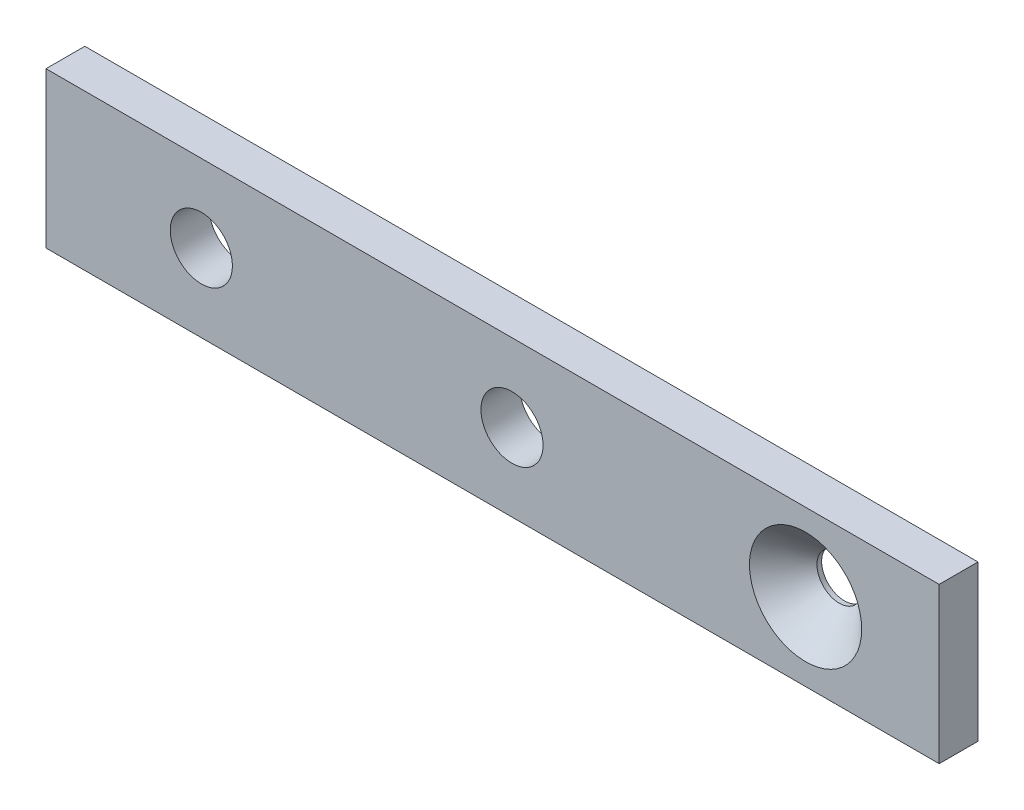
from build123d import *

# Parameters (mm, degrees)
SKETCH1_R           = 2.54
BOSS_EXTRUDE1_DEPTH = 3.175
SKETCH3_R           = 1.5875
CUT_EXTRUDE1_DEPTH  = 49.15125907
CUT_EXTRUDE1_DRAFT  = 5
CHAMFER1_SIZE       = 3
CHAMFER1_SIZE2      = 2.769187039


with BuildPart() as part:
    # Sketch1 → Boss-Extrude1 (new body)
    with BuildSketch(Plane.XY):
        Polygon((47.625, 6.35), (47.625, -6.35), (25.4, -6.35), (-25.4, -6.35), (-25.4, 6.35), (25.4, 6.35), align=None)
        with Locations((12.7, 0)):
            Circle(SKETCH1_R, mode=Mode.SUBTRACT)
        with Locations((-12.7, 0)):
            Circle(SKETCH1_R, mode=Mode.SUBTRACT)
    extrude(amount=BOSS_EXTRUDE1_DEPTH)


with BuildPart() as cut_extrude1_tool:
    # Sketch3 → Cut-Extrude1 (with draft: the straight prism first)
    with BuildSketch(Plane.XY.offset(3.175)):
        with Locations((36.703, 0)):
            Circle(SKETCH3_R)
    extrude(amount=-CUT_EXTRUDE1_DEPTH)
    # Cut-Extrude1: the draft: its side faces are tilted about the plane it starts from
    cut_extrude1_sides = [cut_extrude1_tool.faces().sort_by_distance(p)[0] for p in [
        (35.1155, 0, -21.400629535),
    ]]
    draft(cut_extrude1_sides, Plane.XY.offset(3.175), CUT_EXTRUDE1_DRAFT)


with BuildPart() as part_1:
    add(part.part)

    # Cut-Extrude1: cut by cut_extrude1_tool
    add(cut_extrude1_tool.part, mode=Mode.SUBTRACT)

    # Chamfer1
    chamfer1_edges = [part_1.edges().sort_by_distance(p)[0] for p in [
        (35.1155, 0, 3.175),
    ]]
    chamfer1_side = [part_1.faces().sort_by_distance(p)[0] for p in [
        (46.883788787, 0, 3.175),
    ]]
    chamfer(chamfer1_edges, length=CHAMFER1_SIZE, length2=CHAMFER1_SIZE2, reference=chamfer1_side[0])


solid = part_1.part
